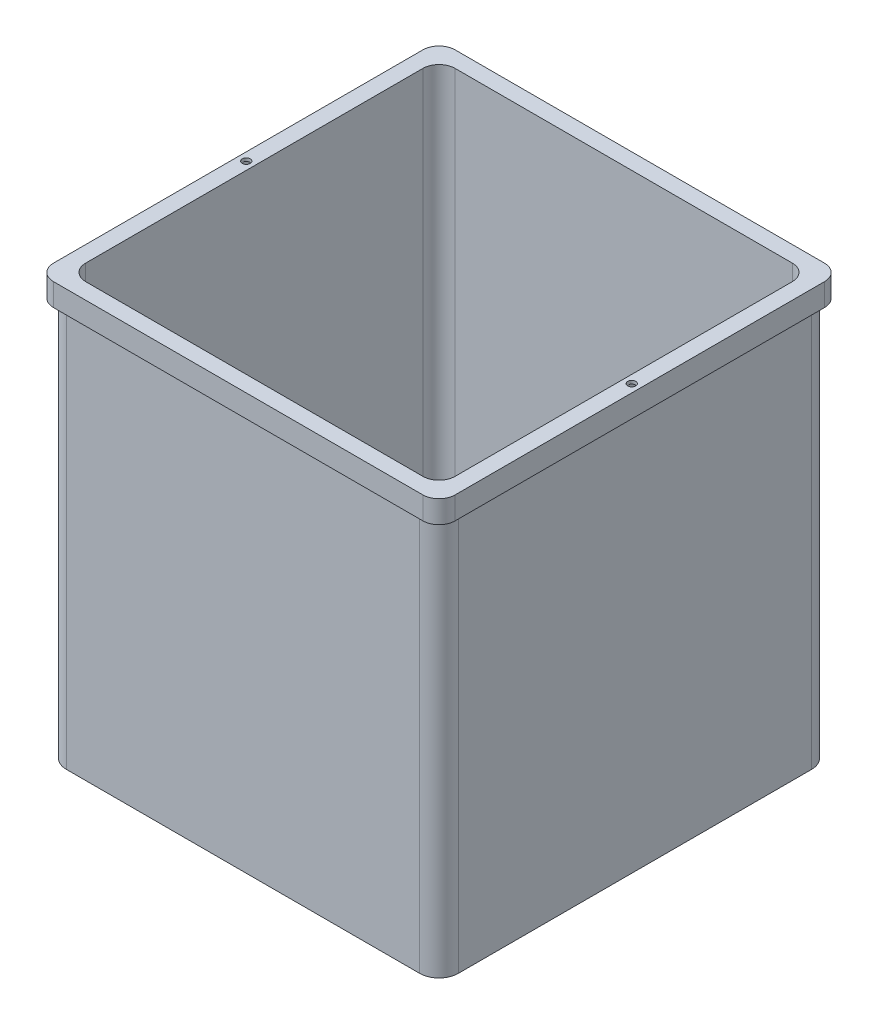
from build123d import *

# Parameters (mm, degrees)
EXTRUDE_1_DEPTH   = 125
EXTRUDE_1_2_DEPTH = 1
EXTRUDE_2_DEPTH   = 115
SKETCH_5_R        = 1.25
EXTRUDE_3_DEPTH   = 1
EXTRUDE_4_REACH   = 155.093
EXTRUDE_START     = -1
EXTRUDE_5_DEPTH   = 1


with BuildPart() as part:
    # 草图1 → Extrude 1 (new body)
    with BuildSketch(Plane(origin=(0, 0, 0), x_dir=(1, 0, 0), z_dir=(0, 1, 0))):
        with BuildLine():
            Line((55, -61), (-55, -61))
            ThreePointArc((-55, -61), (-59.242640687, -59.242640687), (-61, -55))
            Line((-61, -55), (-61, 55))
            ThreePointArc((-61, 55), (-59.242640687, 59.242640687), (-55, 61))
            Line((-55, 61), (55, 61))
            ThreePointArc((55, 61), (59.242640687, 59.242640687), (61, 55))
            Line((61, 55), (61, -55))
            ThreePointArc((61, -55), (59.242640687, -59.242640687), (55, -61))
        make_face()
        with BuildLine():
            Line((55, -60), (-55, -60))
            ThreePointArc((-55, -60), (-58.535533906, -58.535533906), (-60, -55))
            Line((-60, -55), (-60, 55))
            ThreePointArc((-60, 55), (-58.535533906, 58.535533906), (-55, 60))
            Line((-55, 60), (55, 60))
            ThreePointArc((55, 60), (58.535533906, 58.535533906), (60, 55))
            Line((60, 55), (60, -55))
            ThreePointArc((60, -55), (58.535533906, -58.535533906), (55, -60))
        make_face(mode=Mode.SUBTRACT)
    extrude(amount=EXTRUDE_1_DEPTH)

    # 草图2 → Extrude 1 2 (add)
    with BuildSketch(Plane(origin=(0, 5, 0), x_dir=(1, 0, 0), z_dir=(0, 1, 0))):
        with BuildLine():
            Line((-60, 55), (-60, -55))
            ThreePointArc((-60, -55), (-58.535533906, -58.535533906), (-55, -60))
            Line((-55, -60), (55, -60))
            ThreePointArc((55, -60), (58.535533906, -58.535533906), (60, -55))
            Line((60, -55), (60, 55))
            ThreePointArc((60, 55), (58.535533906, 58.535533906), (55, 60))
            Line((55, 60), (-55, 60))
            ThreePointArc((-55, 60), (-58.535533906, 58.535533906), (-60, 55))
        make_face()
    extrude(amount=EXTRUDE_1_2_DEPTH)



with BuildPart() as body_2:
    # 草图4 → 拉伸-薄壁2 (new body)
    with BuildSketch(Plane(origin=(0, 15, 0), x_dir=(1, 0, 0), z_dir=(0, 1, 0))):
        with BuildLine():
            Line((-52.5, 58.5), (52.5, 58.5))
            ThreePointArc((52.5, 58.5), (56.742640687, 56.742640687), (58.5, 52.5))
            Line((58.5, 52.5), (58.5, -52.5))
            ThreePointArc((58.5, -52.5), (56.742640687, -56.742640687), (52.5, -58.5))
            Line((52.5, -58.5), (-52.5, -58.5))
            ThreePointArc((-52.5, -58.5), (-56.742640687, -56.742640687), (-58.5, -52.5))
            Line((-58.5, -52.5), (-58.5, 52.5))
            ThreePointArc((-58.5, 52.5), (-56.742640687, 56.742640687), (-52.5, 58.5))
        make_face()
        with BuildLine():
            Line((-52.5, 57.5), (52.5, 57.5))
            ThreePointArc((52.5, 57.5), (56.035533906, 56.035533906), (57.5, 52.5))
            Line((57.5, 52.5), (57.5, -52.5))
            ThreePointArc((57.5, -52.5), (56.035533906, -56.035533906), (52.5, -57.5))
            Line((52.5, -57.5), (-52.5, -57.5))
            ThreePointArc((-52.5, -57.5), (-56.035533906, -56.035533906), (-57.5, -52.5))
            Line((-57.5, -52.5), (-57.5, 52.5))
            ThreePointArc((-57.5, 52.5), (-56.035533906, 56.035533906), (-52.5, 57.5))
        make_face(mode=Mode.SUBTRACT)
    extrude(amount=EXTRUDE_2_DEPTH)

    # 草图5 → 凸台-拉伸3 (add)
    with BuildSketch(Plane(origin=(0, 130, 0), x_dir=(1, 0, 0), z_dir=(0, 1, 0))):
        with BuildLine():
            Line((-57.5, 62.5), (57.5, 62.5))
            ThreePointArc((57.5, 62.5), (61.035533906, 61.035533906), (62.5, 57.5))
            Line((62.5, 57.5), (62.5, -57.5))
            ThreePointArc((62.5, -57.5), (61.035533906, -61.035533906), (57.5, -62.5))
            Line((57.5, -62.5), (-57.5, -62.5))
            ThreePointArc((-57.5, -62.5), (-61.035533906, -61.035533906), (-62.5, -57.5))
            Line((-62.5, -57.5), (-62.5, 57.5))
            ThreePointArc((-62.5, 57.5), (-61.035533906, 61.035533906), (-57.5, 62.5))
        make_face()
        with Locations(Location((-60, 0, 0), (0, 0, 270))):
            Circle(SKETCH_5_R, mode=Mode.SUBTRACT)
        with Locations(Location((60, 0, 0), (0, 0, 270))):
            Circle(SKETCH_5_R, mode=Mode.SUBTRACT)
        with BuildLine():
            Line((-57.5, 52.5), (-57.5, -52.5))
            ThreePointArc((-57.5, -52.5), (-56.035533906, -56.035533906), (-52.5, -57.5))
            Line((-52.5, -57.5), (52.5, -57.5))
            ThreePointArc((52.5, -57.5), (56.035533906, -56.035533906), (57.5, -52.5))
            Line((57.5, -52.5), (57.5, 52.5))
            ThreePointArc((57.5, 52.5), (56.035533906, 56.035533906), (52.5, 57.5))
            Line((52.5, 57.5), (-52.5, 57.5))
            ThreePointArc((-52.5, 57.5), (-56.035533906, 56.035533906), (-57.5, 52.5))
        make_face(mode=Mode.SUBTRACT)
    extrude(amount=EXTRUDE_3_DEPTH)

    # 草图7 → 凸台-拉伸4 (add, up to next)
    with BuildSketch(Plane(origin=(0, 125, 0), x_dir=(1, 0, 0), z_dir=(0, 1, 0)), mode=Mode.PRIVATE) as extrude_4_sk1:
        with BuildLine():
            Line((62.5, -57.5), (62.5, 57.5))
            ThreePointArc((62.5, 57.5), (61.035533906, 61.035533906), (57.5, 62.5))
            Line((57.5, 62.5), (-57.5, 62.5))
            ThreePointArc((-57.5, 62.5), (-61.035533906, 61.035533906), (-62.5, 57.5))
            Line((-62.5, 57.5), (-62.5, -57.5))
            ThreePointArc((-62.5, -57.5), (-61.035533906, -61.035533906), (-57.5, -62.5))
            Line((-57.5, -62.5), (57.5, -62.5))
            ThreePointArc((57.5, -62.5), (61.035533906, -61.035533906), (62.5, -57.5))
        make_face()
        with BuildLine():
            Line((-56.5, -61.5), (56.5, -61.5))
            ThreePointArc((56.5, -61.5), (60.035533906, -60.035533906), (61.5, -56.5))
            Line((61.5, -56.5), (61.5, 56.5))
            ThreePointArc((61.5, 56.5), (60.035533906, 60.035533906), (56.5, 61.5))
            Line((56.5, 61.5), (-56.5, 61.5))
            ThreePointArc((-56.5, 61.5), (-60.035533906, 60.035533906), (-61.5, 56.5))
            Line((-61.5, 56.5), (-61.5, -56.5))
            ThreePointArc((-61.5, -56.5), (-60.035533906, -60.035533906), (-56.5, -61.5))
        make_face(mode=Mode.SUBTRACT)
    extrude_4_tool1 = extrude(extrude_4_sk1.sketch, amount=EXTRUDE_4_REACH, mode=Mode.PRIVATE) - body_2.part
    add(extrude_4_tool1.solids().sort_by_distance((60.910534, 125, 60.910534))[0])


with BuildPart() as part_1:
    add(part.part)

    add(body_2.part)  # 凸台-拉伸5 merges body 2
    # 草图8 → 凸台-拉伸5 (add)
    with BuildSketch(Plane(origin=(0, 125, 0), x_dir=(1, 0, 0), z_dir=(0, 1, 0)).offset(EXTRUDE_START)):
        with BuildLine():
            Line((-62.5, 57.5), (-62.5, -57.5))
            ThreePointArc((-62.5, -57.5), (-61.035533906, -61.035533906), (-57.5, -62.5))
            Line((-57.5, -62.5), (57.5, -62.5))
            ThreePointArc((57.5, -62.5), (61.035533906, -61.035533906), (62.5, -57.5))
            Line((62.5, -57.5), (62.5, 57.5))
            ThreePointArc((62.5, 57.5), (61.035533906, 61.035533906), (57.5, 62.5))
            Line((57.5, 62.5), (-57.5, 62.5))
            ThreePointArc((-57.5, 62.5), (-61.035533906, 61.035533906), (-62.5, 57.5))
        make_face()
        with BuildLine():
            Line((55, 61), (-55, 61))
            ThreePointArc((-55, 61), (-59.242640687, 59.242640687), (-61, 55))
            Line((-61, 55), (-61, -55))
            ThreePointArc((-61, -55), (-59.242640687, -59.242640687), (-55, -61))
            Line((-55, -61), (55, -61))
            ThreePointArc((55, -61), (59.242640687, -59.242640687), (61, -55))
            Line((61, -55), (61, 55))
            ThreePointArc((61, 55), (59.242640687, 59.242640687), (55, 61))
        make_face(mode=Mode.SUBTRACT)
    extrude(amount=EXTRUDE_5_DEPTH)


solid = part_1.part
